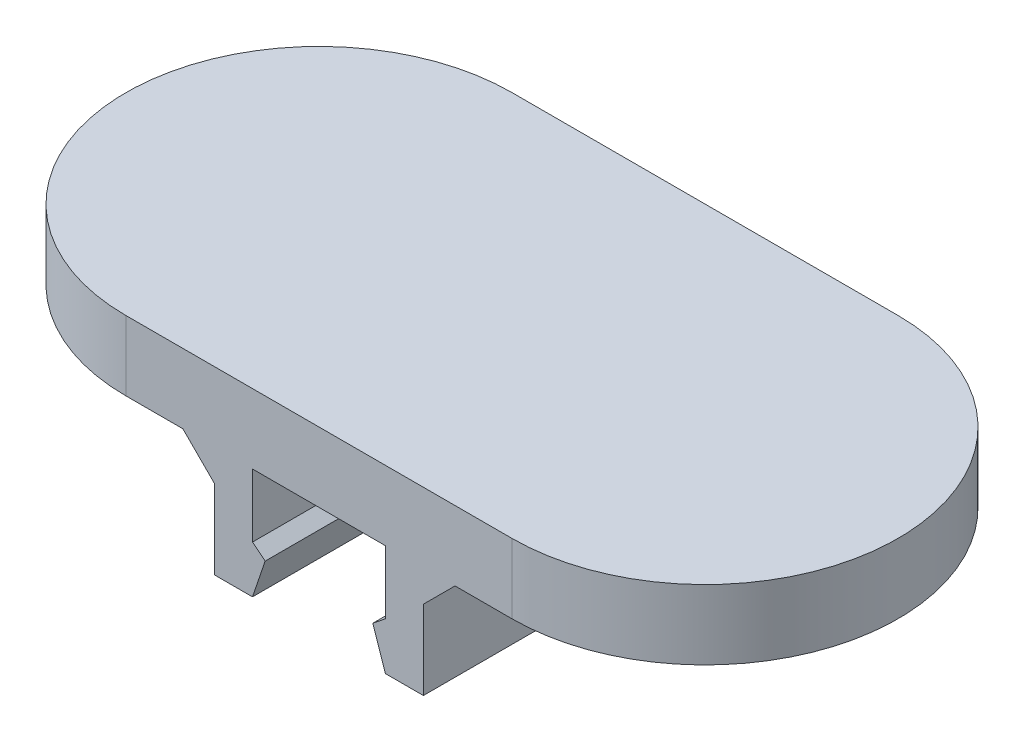
from build123d import *

# Parameters (mm, degrees)
BOSS_EXTRU_1_DEPTH = 2.2
BOSS_EXTRU_2_DEPTH = 6.1
CHANFREIN1_SIZE    = 1


with BuildPart() as part:
    # Esquisse1 → Boss.-Extru.1 (new body)
    with BuildSketch(Plane(origin=(0, 0, 0), x_dir=(1, 0, 0), z_dir=(0, 1, 0))):
        with BuildLine():
            Line((-6.1, 6.1), (6.1, 6.1))
            ThreePointArc((6.1, 6.1), (12.2, 0), (6.1, -6.1))
            Line((6.1, -6.1), (-6.1, -6.1))
            ThreePointArc((-6.1, -6.1), (-12.2, 0), (-6.1, 6.1))
        make_face()
    extrude(amount=BOSS_EXTRU_1_DEPTH)

    # Esquisse2 → Boss.-Extru.2 (add, symmetric)
    with BuildSketch(Plane.XY):
        Polygon((-2.1, 0), (-2.1, -2), (-1.7, -2.32091043), (-2.1, -3.5), (-3.3, -3.5), (-3.3, 0), align=None)
        Polygon((2.1, -3.5), (3.3, -3.5), (3.3, 0), (2.1, 0), (2.1, -2), (1.7, -2.32091043), align=None)
    extrude(amount=BOSS_EXTRU_2_DEPTH, both=True)

    # Chanfrein1
    chanfrein1_edges = [part.edges().sort_by_distance(p)[0] for p in [
        (-3.3, 0, 0),
        (3.3, 0, 0),
    ]]
    chamfer(chanfrein1_edges, length=CHANFREIN1_SIZE)


solid = part.part
